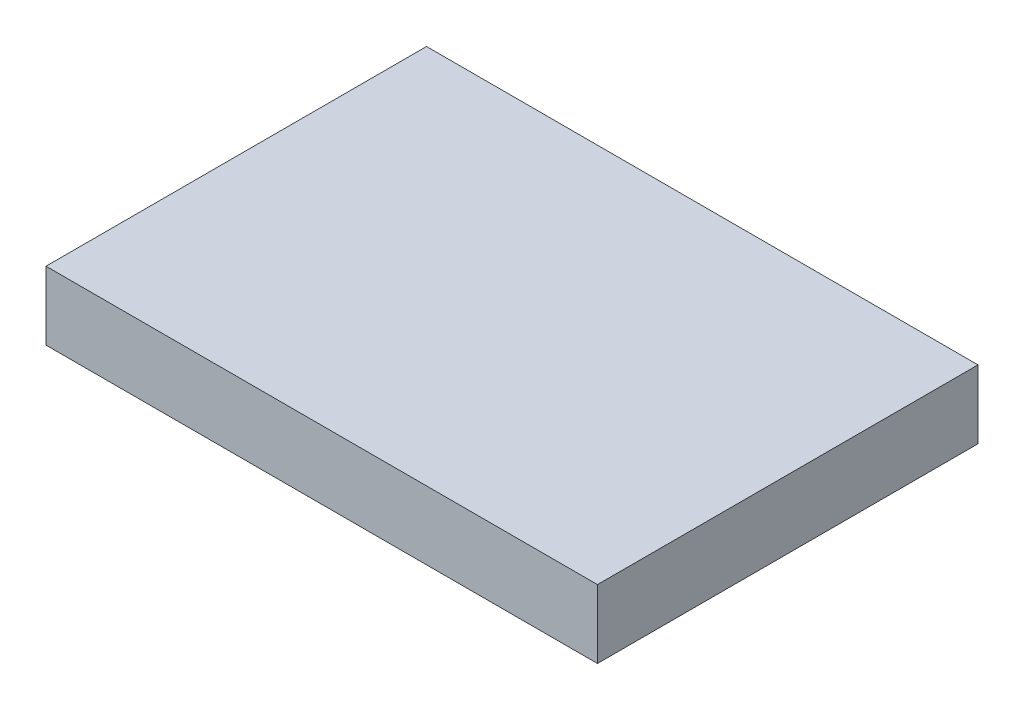
from build123d import *

# Parameters (mm, degrees)
SKETCH1_W           = 614.68
SKETCH1_H           = 424.18
BOSS_EXTRUDE2_DEPTH = 76.2


with BuildPart() as part:
    # Sketch1 → Boss-Extrude2 (new body)
    with BuildSketch(Plane(origin=(0, 0, 0), x_dir=(1, 0, 0), z_dir=(0, 1, 0))):
        with Locations((324.04, 156.567716774)):
            Rectangle(SKETCH1_W, SKETCH1_H)
    extrude(amount=BOSS_EXTRUDE2_DEPTH)


solid = part.part
